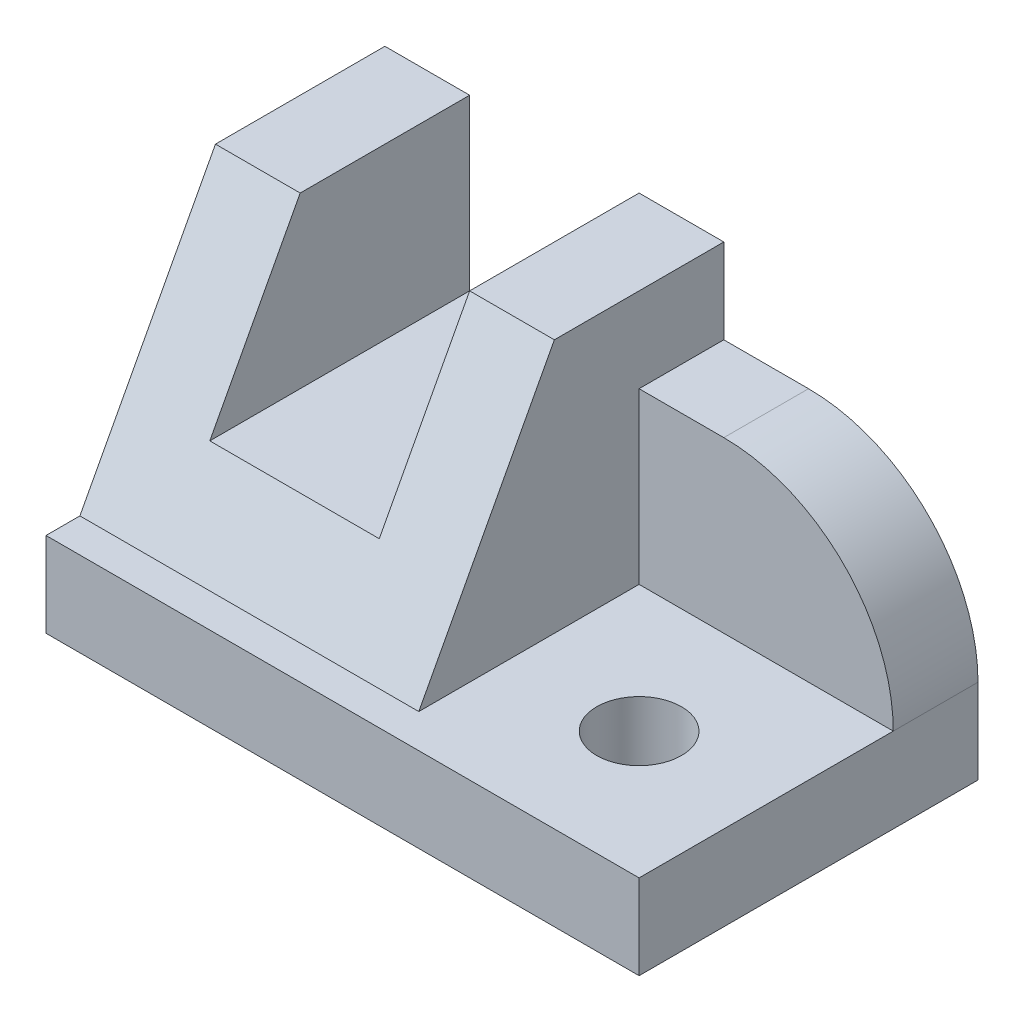
from build123d import *

# Parameters (mm, degrees)
BOSS_EXTRUDE1_DEPTH            = 40
SKETCH2_W                      = 40
SKETCH2_H                      = 30
BOSS_EXTRUDE2_DEPTH            = 20
BOSS_EXTRUDE3_DEPTH            = 30
CUT_EXTRUDE1_DEPTH             = 30
SKETCH5_W                      = 70
SKETCH5_H                      = 40
BOSS_EXTRUDE4_DEPTH            = 10
SKETCH6_W                      = 20
SKETCH6_H                      = 20
CUT_EXTRUDE2_DEPTH             = 91
F_10_0_10_DIAMETER_HOLE1_D     = 10
F_10_0_10_DIAMETER_HOLE1_DEPTH = 40
FILLET1_R                      = 20


with BuildPart() as part:
    # Sketch1 → Boss-Extrude1 (new body)
    with BuildSketch(Plane(origin=(0, 0, 0), x_dir=(0, -1, 0), z_dir=(-1, 0, 0))):
        Polygon((-10, -4), (-40, -20), (-10, -20), align=None)
    extrude(amount=-BOSS_EXTRUDE1_DEPTH)

    # Sketch2 → Boss-Extrude2 (add)
    with BuildSketch(Plane(origin=(0, 0, -20), x_dir=(-1, 0, 0), z_dir=(0, 0, -1))):
        with Locations((-20, 25)):
            Rectangle(SKETCH2_W, SKETCH2_H)
    extrude(amount=BOSS_EXTRUDE2_DEPTH)

    # Sketch3 → Boss-Extrude3 (add)
    with BuildSketch(Plane(origin=(40, 0, 0), x_dir=(0, 0, -1), z_dir=(1, 0, 0))):
        Polygon((40, 10), (0, 10), (20, 40), (40, 40), align=None)
    extrude(amount=BOSS_EXTRUDE3_DEPTH)

    # Sketch4 → Cut-Extrude1 (cut)
    with BuildSketch(Plane(origin=(70, 0, 0), x_dir=(0, 0, -1), z_dir=(1, 0, 0))):
        Polygon((20, 40), (0, 10), (30, 10), (30, 30), (40, 30), (40, 40), align=None)
    extrude(amount=-CUT_EXTRUDE1_DEPTH, mode=Mode.SUBTRACT)

    # Sketch5 → Boss-Extrude4 (add)
    with BuildSketch(Plane.XZ.offset(-10)):
        with Locations((35, -20)):
            Rectangle(SKETCH5_W, SKETCH5_H)
    extrude(amount=BOSS_EXTRUDE4_DEPTH)

    # Sketch6 → Cut-Extrude2 (cut, through all)
    with BuildSketch(Plane(origin=(0, 0, -40), x_dir=(-1, 0, 0), z_dir=(0, 0, -1))):
        with Locations((-20, 30)):
            Rectangle(SKETCH6_W, SKETCH6_H)
    extrude(amount=-CUT_EXTRUDE2_DEPTH, mode=Mode.SUBTRACT)

    # Ø10.0 (10) Diameter Hole1
    with Locations(Plane(origin=(0, 0, 0), x_dir=(-1, 0, 0), z_dir=(0, -1, 0))):
        with Locations((-55, 15)):
            Hole(F_10_0_10_DIAMETER_HOLE1_D / 2, depth=F_10_0_10_DIAMETER_HOLE1_DEPTH)

    # Fillet1
    fillet1_edges = [part.edges().sort_by_distance(p)[0] for p in [
        (70, 30, -35),
    ]]
    fillet(fillet1_edges, radius=FILLET1_R)


solid = part.part
